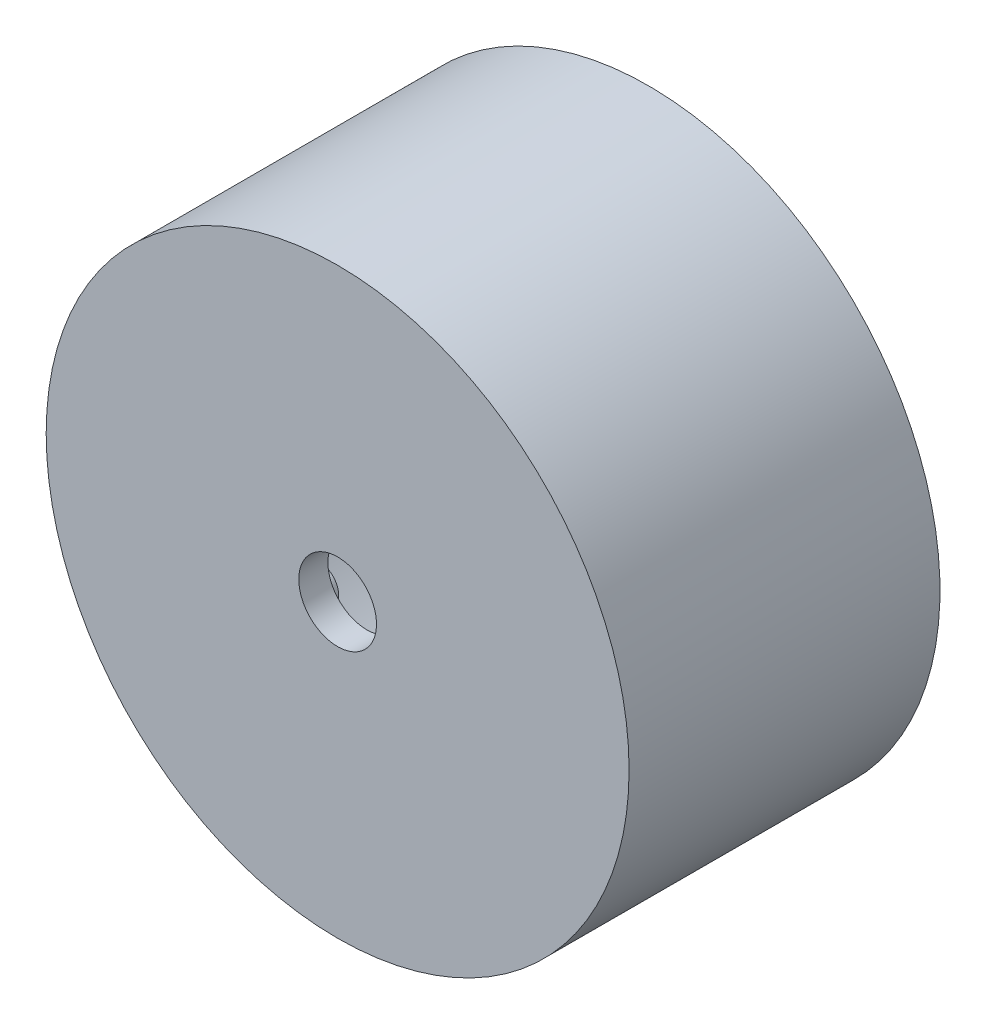
from build123d import *

# Parameters (mm, degrees)
SKETCH1_R               = 30
BOSS_EXTRUDE1_DEPTH     = 35
SHELL3_T                = 3
CUT_EXTRUDE2_DEPTH      = 56
CUT_EXTRUDE2_DEPTH_BACK = 56
SKETCH3_R               = 4
CUT_EXTRUDE3_DEPTH      = 56
CUT_EXTRUDE3_DEPTH_BACK = 3
SKETCH4_R               = 30
BOSS_EXTRUDE2_START     = -18
SKETCH2_R               = 2
BOSS_EXTRUDE2_DEPTH     = 14
BOSS_EXTRUDE2_2_DEPTH   = 14
BOSS_EXTRUDE2_3_DEPTH   = 14
BOSS_EXTRUDE2_4_DEPTH   = 14
BOSS_EXTRUDE2_5_DEPTH   = 14
BOSS_EXTRUDE2_6_DEPTH   = 14
BOSS_EXTRUDE2_7_DEPTH   = 14
BOSS_EXTRUDE2_8_DEPTH   = 14
BOSS_EXTRUDE2_9_DEPTH   = 14
BOSS_EXTRUDE2_10_DEPTH  = 14
BOSS_EXTRUDE2_11_DEPTH  = 14


with BuildPart() as part:
    # Sketch1 → Boss-Extrude1 (new body)
    with BuildSketch(Plane.XY):
        Circle(SKETCH1_R)
    extrude(amount=BOSS_EXTRUDE1_DEPTH)

    # Shell3 (no face opened: a closed hollow body)
    add(offset(amount=-SHELL3_T, mode=Mode.PRIVATE), mode=Mode.SUBTRACT)

    # Sketch3 → Cut-Extrude2 (cut, two sides: drawn at the far end of the back side and taken through both)
    with BuildSketch(Plane(origin=(0, 0, 0), x_dir=(-1, 0, 0), z_dir=(0, 0, -1)).offset(-CUT_EXTRUDE2_DEPTH_BACK)):
        with Locations(Location((0, 0, 0), (0, 0, 180))):
            Circle(SKETCH3_R)
    extrude(amount=CUT_EXTRUDE2_DEPTH + CUT_EXTRUDE2_DEPTH_BACK, mode=Mode.SUBTRACT)

    # Sketch4 → Cut-Extrude3 (cut, two sides: drawn at the far end of the back side and taken through both)
    with BuildSketch(Plane(origin=(0, 0, 0), x_dir=(-1, 0, 0), z_dir=(0, 0, -1)).offset(-CUT_EXTRUDE3_DEPTH_BACK)):
        Circle(SKETCH4_R)
    extrude(amount=CUT_EXTRUDE3_DEPTH + CUT_EXTRUDE3_DEPTH_BACK, mode=Mode.SUBTRACT)


with BuildPart() as body_2:
    # Sketch2 → Boss-Extrude2 (new body)
    with BuildSketch(Plane(origin=(0, 0, 0), x_dir=(-1, 0, 0), z_dir=(0, 0, -1)).offset(BOSS_EXTRUDE2_START)):
        with Locations((0, 25)):
            Circle(SKETCH2_R)
    extrude(amount=-BOSS_EXTRUDE2_DEPTH)


with BuildPart() as body_3:
    # Sketch2 → Boss-Extrude2 2 (new body)
    with BuildSketch(Plane(origin=(0, 0, 0), x_dir=(-1, 0, 0), z_dir=(0, 0, -1)).offset(BOSS_EXTRUDE2_START)):
        with Locations((13.516020436, 21.031338321)):
            Circle(SKETCH2_R)
    extrude(amount=-BOSS_EXTRUDE2_2_DEPTH)


with BuildPart() as body_4:
    # Sketch2 → Boss-Extrude2 3 (new body)
    with BuildSketch(Plane(origin=(0, 0, 0), x_dir=(-1, 0, 0), z_dir=(0, 0, -1)).offset(BOSS_EXTRUDE2_START)):
        with Locations((22.740799884, 10.385375325)):
            Circle(SKETCH2_R)
    extrude(amount=-BOSS_EXTRUDE2_3_DEPTH)


with BuildPart() as body_5:
    # Sketch2 → Boss-Extrude2 4 (new body)
    with BuildSketch(Plane(origin=(0, 0, 0), x_dir=(-1, 0, 0), z_dir=(0, 0, -1)).offset(BOSS_EXTRUDE2_START)):
        with Locations((24.745536047, -3.557870957)):
            Circle(SKETCH2_R)
    extrude(amount=-BOSS_EXTRUDE2_4_DEPTH)


with BuildPart() as body_6:
    # Sketch2 → Boss-Extrude2 5 (new body)
    with BuildSketch(Plane(origin=(0, 0, 0), x_dir=(-1, 0, 0), z_dir=(0, 0, -1)).offset(BOSS_EXTRUDE2_START)):
        with Locations((18.893739359, -16.371518349)):
            Circle(SKETCH2_R)
    extrude(amount=-BOSS_EXTRUDE2_5_DEPTH)


with BuildPart() as body_7:
    # Sketch2 → Boss-Extrude2 6 (new body)
    with BuildSketch(Plane(origin=(0, 0, 0), x_dir=(-1, 0, 0), z_dir=(0, 0, -1)).offset(BOSS_EXTRUDE2_START)):
        with Locations((7.043313921, -23.98732434)):
            Circle(SKETCH2_R)
    extrude(amount=-BOSS_EXTRUDE2_6_DEPTH)


with BuildPart() as body_8:
    # Sketch2 → Boss-Extrude2 7 (new body)
    with BuildSketch(Plane(origin=(0, 0, 0), x_dir=(-1, 0, 0), z_dir=(0, 0, -1)).offset(BOSS_EXTRUDE2_START)):
        with Locations((-7.043313921, -23.98732434)):
            Circle(SKETCH2_R)
    extrude(amount=-BOSS_EXTRUDE2_7_DEPTH)


with BuildPart() as body_9:
    # Sketch2 → Boss-Extrude2 8 (new body)
    with BuildSketch(Plane(origin=(0, 0, 0), x_dir=(-1, 0, 0), z_dir=(0, 0, -1)).offset(BOSS_EXTRUDE2_START)):
        with Locations((-18.893739359, -16.371518349)):
            Circle(SKETCH2_R)
    extrude(amount=-BOSS_EXTRUDE2_8_DEPTH)


with BuildPart() as body_10:
    # Sketch2 → Boss-Extrude2 9 (new body)
    with BuildSketch(Plane(origin=(0, 0, 0), x_dir=(-1, 0, 0), z_dir=(0, 0, -1)).offset(BOSS_EXTRUDE2_START)):
        with Locations((-24.745536047, -3.557870957)):
            Circle(SKETCH2_R)
    extrude(amount=-BOSS_EXTRUDE2_9_DEPTH)


with BuildPart() as body_11:
    # Sketch2 → Boss-Extrude2 10 (new body)
    with BuildSketch(Plane(origin=(0, 0, 0), x_dir=(-1, 0, 0), z_dir=(0, 0, -1)).offset(BOSS_EXTRUDE2_START)):
        with Locations((-22.740799884, 10.385375325)):
            Circle(SKETCH2_R)
    extrude(amount=-BOSS_EXTRUDE2_10_DEPTH)


with BuildPart() as body_12:
    # Sketch2 → Boss-Extrude2 11 (new body)
    with BuildSketch(Plane(origin=(0, 0, 0), x_dir=(-1, 0, 0), z_dir=(0, 0, -1)).offset(BOSS_EXTRUDE2_START)):
        with Locations((-13.516020436, 21.031338321)):
            Circle(SKETCH2_R)
    extrude(amount=-BOSS_EXTRUDE2_11_DEPTH)


solid = Compound([part.part, body_2.part, body_3.part, body_4.part, body_5.part, body_6.part, body_7.part, body_8.part, body_9.part, body_10.part, body_11.part, body_12.part])
